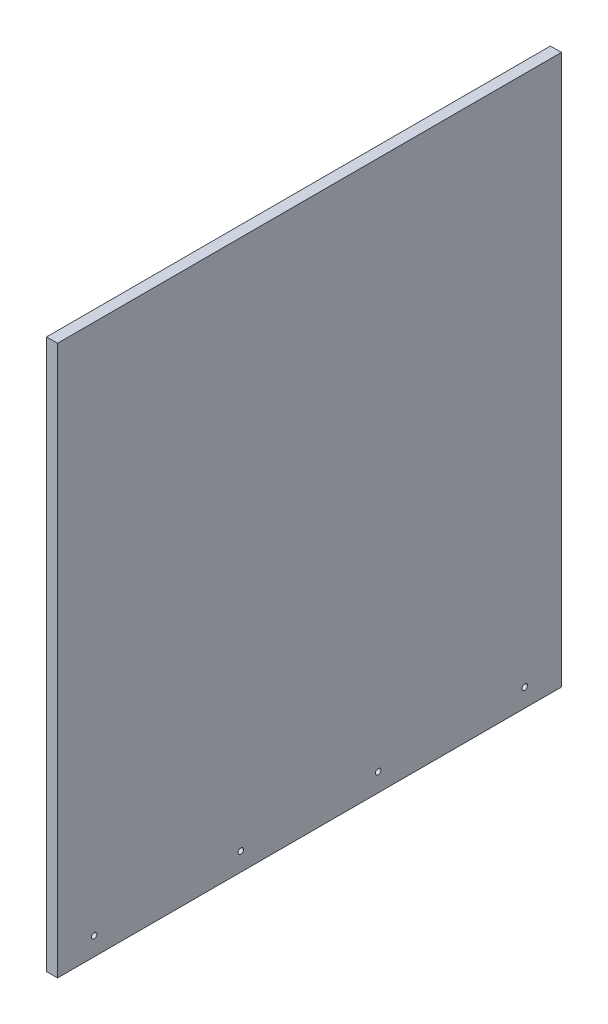
from build123d import *

# Parameters (mm, degrees)
SKETCH1_W               = 6
SKETCH1_H               = 300
BOSS_EXTRUDE1_DEPTH     = 137.5
CUT_EXTRUDE1_DEPTH      = 204.507370874
CUT_EXTRUDE1_DEPTH_BACK = 204.507370874
SKETCH2_R               = 1.5


with BuildPart() as part:
    # Sketch1 → Boss-Extrude1 (new, symmetric)
    with BuildSketch(Plane.XY):
        Rectangle(SKETCH1_W, SKETCH1_H)
    extrude(amount=BOSS_EXTRUDE1_DEPTH, both=True)

    # Sketch2 → Cut-Extrude1 (cut, two sides: drawn at the far end of the back side and taken through both)
    with BuildSketch(Plane(origin=(0, 0, 0), x_dir=(0, 0, -1), z_dir=(1, 0, 0)).offset(-CUT_EXTRUDE1_DEPTH_BACK)):
        with Locations((-117.5, -140)):
            Circle(SKETCH2_R)
        with Locations((-37.5, -140)):
            Circle(SKETCH2_R)
        with Locations(Location((37.5, -140, 0), (0, 0, 180))):
            Circle(SKETCH2_R)
        with Locations(Location((117.5, -140, 0), (0, 0, 180))):
            Circle(SKETCH2_R)
    extrude(amount=CUT_EXTRUDE1_DEPTH + CUT_EXTRUDE1_DEPTH_BACK, mode=Mode.SUBTRACT)


solid = part.part
